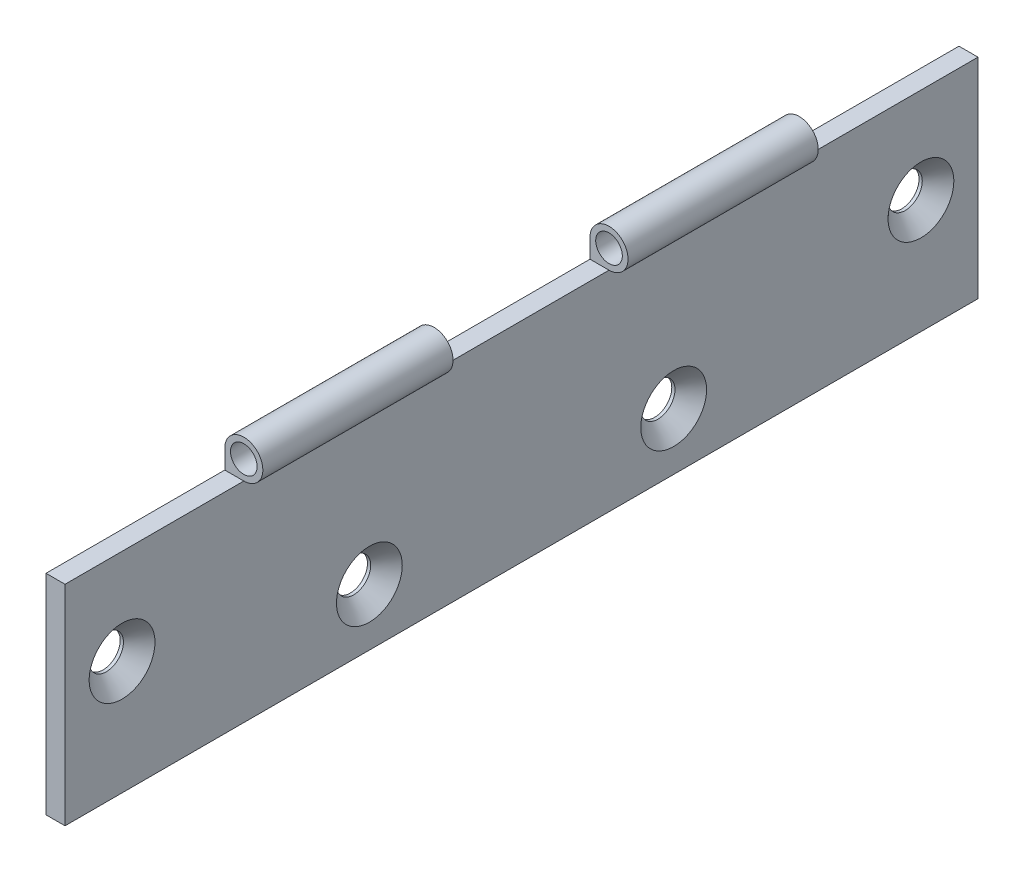
from build123d import *

# Parameters (mm, degrees)
SKETCH_1_W                 = 5
SKETCH_1_H                 = 60
EXTRUDE_1_DEPTH            = 120
SKETCH_2_R                 = 5
SKETCH_4_R                 = 3.5
CUT_EXTRUDE_1_DEPTH        = 249.847342763
HOLE_WIZARD_M81_AT_2_COUNT = 2
HOLE_WIZARD_M81_AT_2_PITCH = 66.708320321
CUT_EXTRUDE_2_DEPTH        = 137.565002837
CUT_EXTRUDE_2_DEPTH_BACK   = 137.565002837
SKETCH_7_W                 = 47
SKETCH_7_H                 = 10
SKETCH_7_W_2               = 46


with BuildPart() as part:
    # Эскиз1 → Вытянуть-Тонкостенный1 (new, symmetric)
    with BuildSketch(Plane.XY):
        with Locations((2.5, 30)):
            Rectangle(SKETCH_1_W, SKETCH_1_H)
    extrude(amount=EXTRUDE_1_DEPTH, both=True)

    # По траектории1: sweep along a curve in space
    with BuildLine() as sweep_1_path:
        Line((5, 60, 120), (5, 60, -120))
    # Эскиз2 → По траектории1 (sweep)
    with BuildSketch(Plane.XY.offset(120)):
        with Locations((5, 60)):
            Circle(SKETCH_2_R)
    sweep(path=sweep_1_path.line)

    # Эскиз4 → Вырез-Вытянуть1 (cut, through all)
    with BuildSketch(Plane.XY.offset(120)):
        with Locations((5, 60)):
            Circle(SKETCH_4_R)
    extrude(amount=-CUT_EXTRUDE_1_DEPTH, mode=Mode.SUBTRACT)

    # Эскиз5 → Зенковка для  винта с плоской головкой M81 (revolve, cut)
    with BuildSketch(Plane(origin=(5, 30, 105), x_dir=(0, 0, -1), z_dir=(0, 1, 0))):
        Polygon((0, 0), (0, 5), (4.5, 5), (4.5, 4.15), (8.65, 0), align=None)
    hole_wizard_m81 = revolve(axis=Axis((11.35, 30, 105), (-1, 0, 0)), mode=Mode.SUBTRACT)

    # Зенковка для  винта с плоской головкой M81 at 2: Зенковка для  винта с плоской головкой M81 ×2
    with Locations(*[Vector(0, -0.22485950669875843, -0.9743911956946198) * (i * HOLE_WIZARD_M81_AT_2_PITCH) for i in range(1, HOLE_WIZARD_M81_AT_2_COUNT)]):
        add(hole_wizard_m81, mode=Mode.SUBTRACT)

    # Зеркальное отражение1: Зенковка для  винта с плоской головкой M81 across plane
    add(hole_wizard_m81.mirror(Plane.XY), mode=Mode.SUBTRACT)

    # Зеркальное отражение1 copy 1 sketch → Зеркальное отражение1 copy 1 (revolve, cut)
    with BuildSketch(Plane(origin=(5, 15, -40), x_dir=(0, 0, 1), z_dir=(0, 1, 0))):
        Polygon((0, 0), (0, -5), (4.5, -5), (4.5, -4.15), (8.65, 0), align=None)
    revolve(axis=Axis((11.35, 15, -40), (1, 0, 0)), mode=Mode.SUBTRACT)

    # Эскиз7 → Вырез-Вытянуть2 (cut, two sides: drawn at the far end of the back side and taken through both)
    with BuildSketch(Plane(origin=(5, 0, 0), x_dir=(0, 0, -1), z_dir=(1, 0, 0)).offset(-CUT_EXTRUDE_2_DEPTH_BACK)):
        with Locations((96.5, 60)):
            Rectangle(SKETCH_7_W, SKETCH_7_H)
        with Locations((0, 60)):
            Rectangle(SKETCH_7_W_2, SKETCH_7_H)
        with Locations((-96.5, 60)):
            Rectangle(SKETCH_7_W, SKETCH_7_H)
    extrude(amount=CUT_EXTRUDE_2_DEPTH + CUT_EXTRUDE_2_DEPTH_BACK, mode=Mode.SUBTRACT)


solid = part.part
